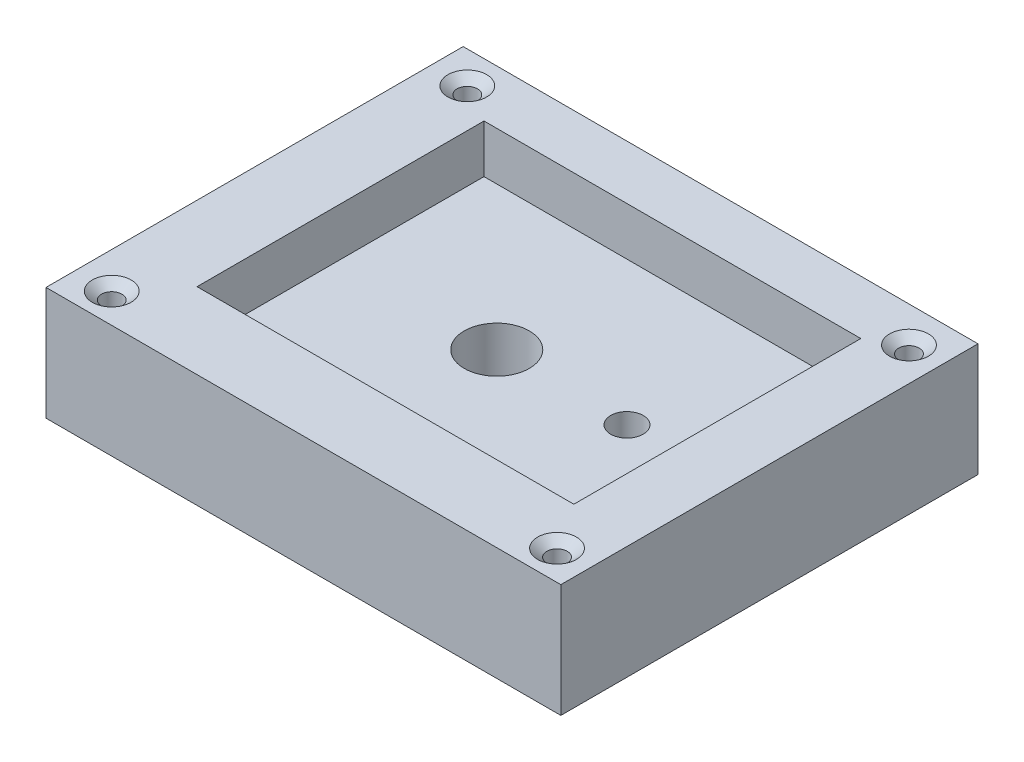
from build123d import *

# Parameters (mm, degrees)
SKETCH1_W                       = 50.2158
SKETCH1_H                       = 40.6908
BOSS_EXTRUDE1_DEPTH             = 11.049
SKETCH2_W                       = 36.7538
SKETCH2_H                       = 27.9908
CUT_EXTRUDE1_DEPTH              = 4.699
SKETCH3_R                       = 3.175
SKETCH3_R_2                     = 1.5875
CUT_EXTRUDE2_DEPTH              = 65.943746999
F_3_48_TAPPED_HOLE1_D           = 1.9939
F_3_48_TAPPED_HOLE1_CSINK_D     = 3.7846
F_3_48_TAPPED_HOLE1_CSINK_ANGLE = 100


with BuildPart() as part:
    # Sketch1 → Boss-Extrude1 (new body)
    with BuildSketch(Plane(origin=(0, 0, 0), x_dir=(1, 0, 0), z_dir=(0, 1, 0))):
        with Locations((-25.1079, 20.3454)):
            Rectangle(SKETCH1_W, SKETCH1_H)
    extrude(amount=BOSS_EXTRUDE1_DEPTH)

    # Sketch2 → Cut-Extrude1 (cut)
    with BuildSketch(Plane(origin=(0, 11.049, 0), x_dir=(1, 0, 0), z_dir=(0, 1, 0))):
        with Locations((-24.535409395, 21.423766617)):
            Rectangle(SKETCH2_W, SKETCH2_H)
    extrude(amount=-CUT_EXTRUDE1_DEPTH, mode=Mode.SUBTRACT)

    # Sketch3 → Cut-Extrude2 (cut, through all)
    with BuildSketch(Plane(origin=(0, 6.35, 0), x_dir=(1, 0, 0), z_dir=(0, 1, 0))):
        with Locations(Location((-27.672309395, 21.423766617, 0), (0, 0, 270))):
            Circle(SKETCH3_R)
        with Locations(Location((-14.972309395, 21.423766617, 0), (0, 0, 270))):
            Circle(SKETCH3_R_2)
    extrude(amount=-CUT_EXTRUDE2_DEPTH, mode=Mode.SUBTRACT)

    # #3-48 Tapped Hole1 (through all)
    with Locations(Plane(origin=(0, 11.049, 0), x_dir=(1, 0, 0), z_dir=(0, 1, 0))):
        with Locations((-46.696611007, 37.574228679), (-3.259865138, 37.217658377), (-46.696611007, 2.889662947), (-3.259865138, 2.889662947)):
            CounterSinkHole(F_3_48_TAPPED_HOLE1_D / 2, F_3_48_TAPPED_HOLE1_CSINK_D / 2, counter_sink_angle=F_3_48_TAPPED_HOLE1_CSINK_ANGLE)


solid = part.part
